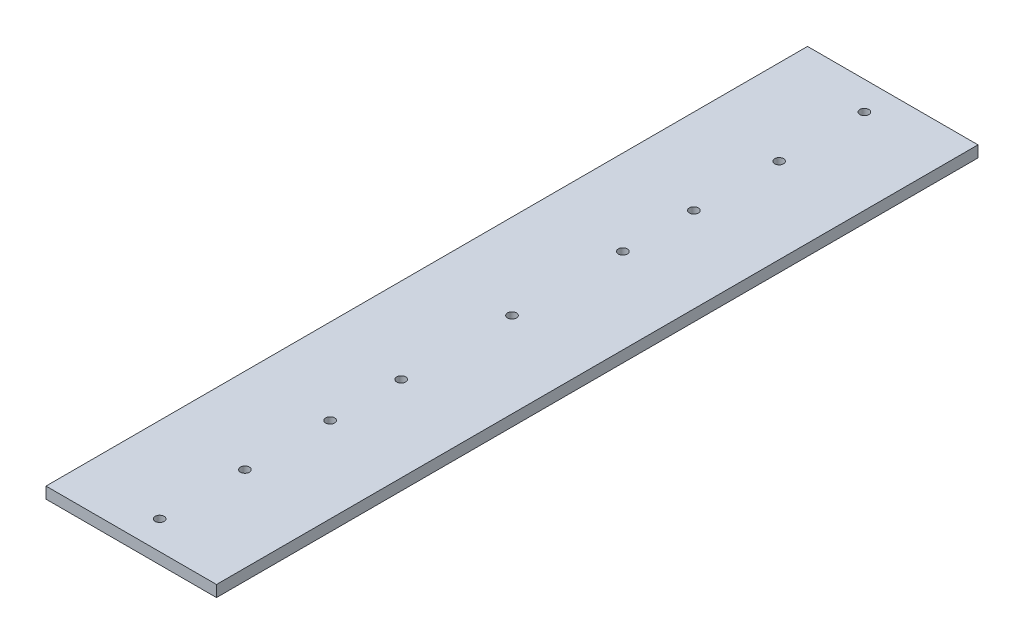
from build123d import *

# Parameters (mm, degrees)
SKETCH2_W           = 60
SKETCH2_H           = 268
SKETCH2_R           = 1.58
BOSS_EXTRUDE1_DEPTH = 4


with BuildPart() as part:
    # Sketch2 → Boss-Extrude1 (new body)
    with BuildSketch(Plane(origin=(0, 0, 0), x_dir=(1, 0, 0), z_dir=(0, 1, 0))):
        with Locations((-95.454545455, 93.772727273)):
            Rectangle(SKETCH2_W, SKETCH2_H)
        with Locations(Location((-95.454545455, 217.772727273, 0), (0, 0, 270))):
            Circle(SKETCH2_R, mode=Mode.SUBTRACT)
        with Locations(Location((-95.454545455, 187.772727273, 0), (0, 0, 270))):
            Circle(SKETCH2_R, mode=Mode.SUBTRACT)
        with Locations(Location((-95.454545455, 157.772727273, 0), (0, 0, 270))):
            Circle(SKETCH2_R, mode=Mode.SUBTRACT)
        with Locations(Location((-95.454545455, 132.772727273, 0), (0, 0, 270))):
            Circle(SKETCH2_R, mode=Mode.SUBTRACT)
        with Locations(Location((-95.454545455, 93.772727273, 0), (0, 0, 270))):
            Circle(SKETCH2_R, mode=Mode.SUBTRACT)
        with Locations(Location((-95.454545455, 54.772727273, 0), (0, 0, 270))):
            Circle(SKETCH2_R, mode=Mode.SUBTRACT)
        with Locations(Location((-95.454545455, 29.772727273, 0), (0, 0, 270))):
            Circle(SKETCH2_R, mode=Mode.SUBTRACT)
        with Locations(Location((-95.454545455, -0.227272727, 0), (0, 0, 270))):
            Circle(SKETCH2_R, mode=Mode.SUBTRACT)
        with Locations(Location((-95.454545455, -30.227272727, 0), (0, 0, 270))):
            Circle(SKETCH2_R, mode=Mode.SUBTRACT)
    extrude(amount=BOSS_EXTRUDE1_DEPTH)


solid = part.part
